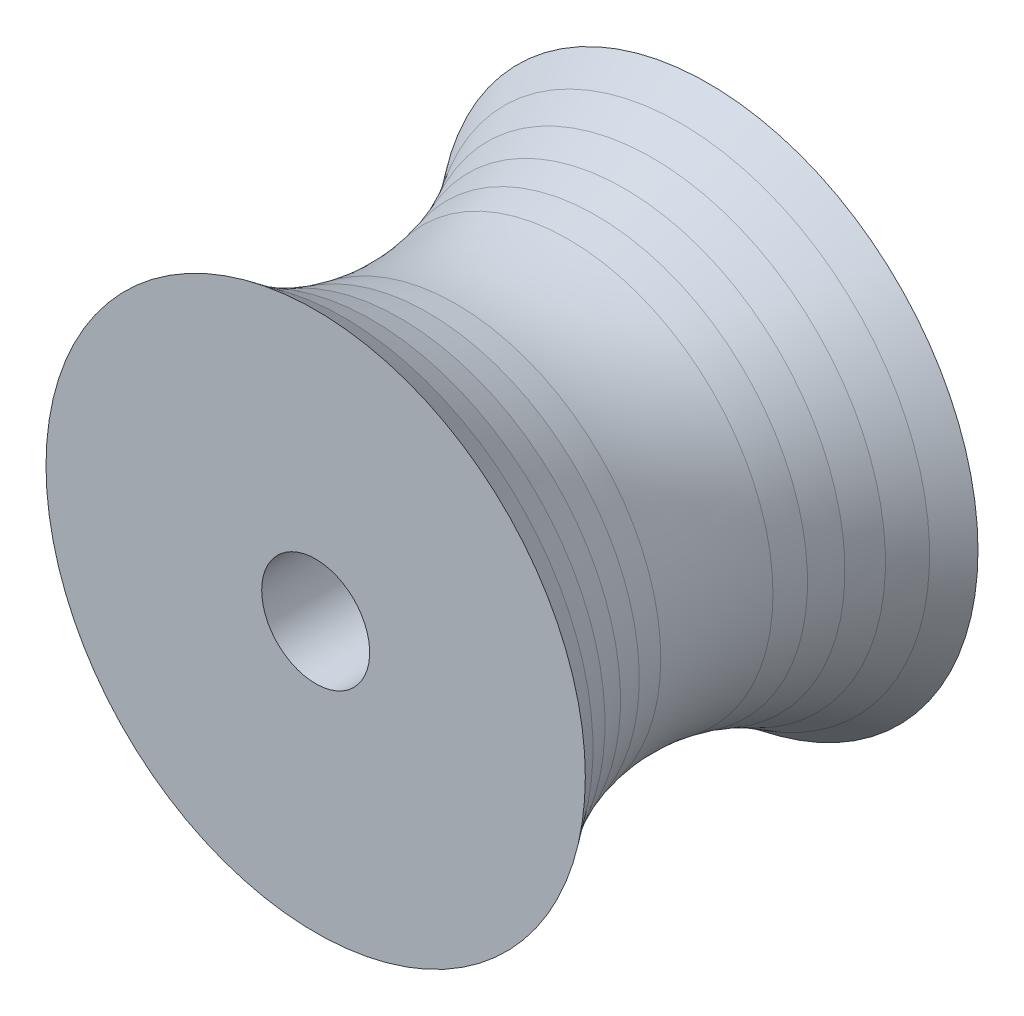
from build123d import *


with BuildPart() as part:
    # Revolve profile 1 → Revolve 1 (revolve)
    with BuildSketch(Plane(origin=(0, 0, 0), x_dir=(1, 0, 0), z_dir=(0, 1, 0)), mode=Mode.PRIVATE) as revolve_1_sk:
        with BuildLine():
            Line((5.5, -20), (5.5, 20))
            Line((5.5, 20), (27.469967387, 20))
            Line((27.469967387, 20), (25.394644355, 17.142857143))
            Line((25.394644355, 17.142857143), (23.757463511, 14.285714286))
            Line((23.757463511, 14.285714286), (22.485423007, 11.428571429))
            Line((22.485423007, 11.428571429), (21.532753452, 8.571428571))
            Line((21.532753452, 8.571428571), (20.87011984, 5.714285714))
            ThreePointArc((20.87011984, 5.714285714), (20.35, 0), (20.87011984, -5.714285714))
            Line((20.87011984, -5.714285714), (21.532753452, -8.571428571))
            Line((21.532753452, -8.571428571), (22.485423007, -11.428571429))
            Line((22.485423007, -11.428571429), (23.757463511, -14.285714286))
            Line((23.757463511, -14.285714286), (25.394644355, -17.142857143))
            Line((25.394644355, -17.142857143), (27.469967387, -20))
            Line((27.469967387, -20), (5.5, -20))
        make_face()
    revolve(revolve_1_sk.sketch.rotate(Axis((0, 0, -25), (0, 0, 1)), 180), axis=Axis((0, 0, -25), (0, 0, 1)))


solid = part.part
